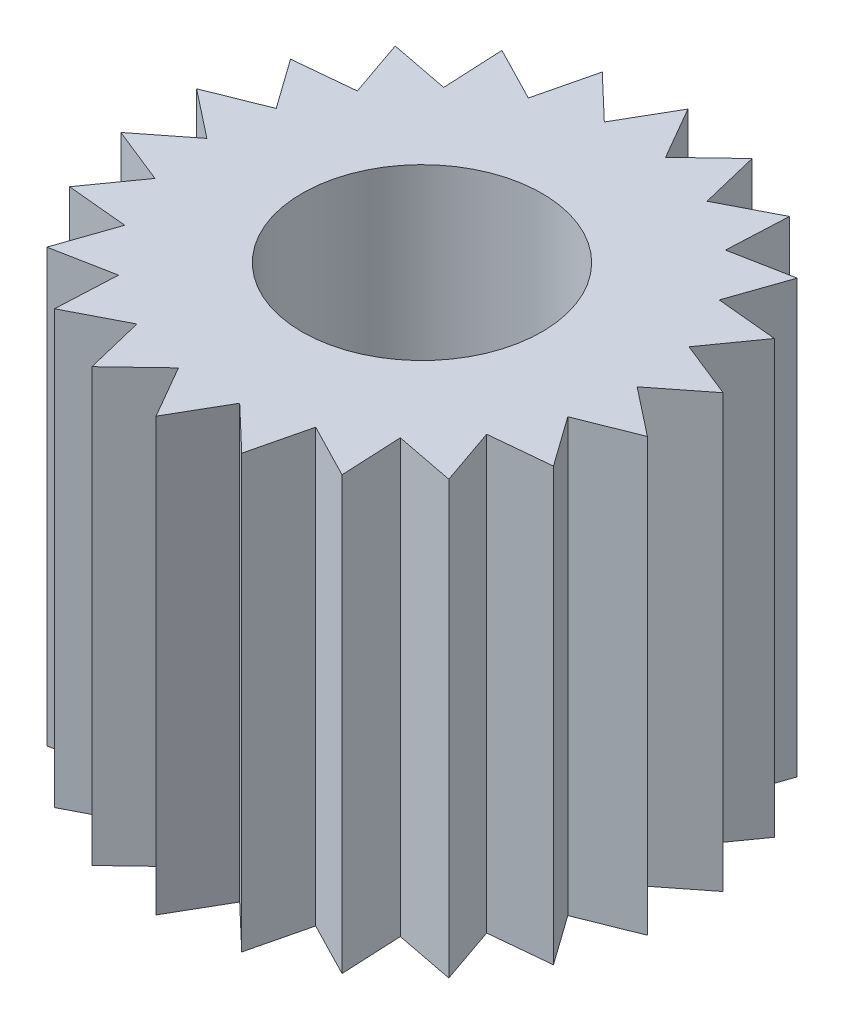
from build123d import *

# Parameters (mm, degrees)
SKETCH1_R           = 2.5
BOSS_EXTRUDE1_DEPTH = 9


with BuildPart() as part:
    # Sketch1 → Boss-Extrude1 (new body)
    with BuildSketch(Plane(origin=(0, 0, 0), x_dir=(1, 0, 0), z_dir=(0, 1, 0))):
        Polygon((1.561153305, 5.316799887), (0.637864624, 4.436445909), (0, 5.541259846), (-0.637864624, 4.436445909), (-1.561153305, 5.316799887), (-1.861917874, 4.077031446), (-2.995831253, 4.661604422), (-2.935129611, 3.387320142), (-4.18780477, 3.62875349), (-3.770554603, 2.423188306), (-5.040507251, 2.301922531), (-4.300511685, 1.262744164), (-5.484857811, 0.788603499), (-4.482066887, 0), (-5.484857811, -0.788603499), (-4.300511685, -1.262744164), (-5.040507251, -2.301922531), (-3.770554603, -2.423188306), (-4.18780477, -3.62875349), (-2.935129611, -3.387320142), (-2.941213111, -3.515028519), (-2.995831253, -4.661604422), (-1.861917874, -4.077031446), (-1.561153305, -5.316799887), (-0.637864624, -4.436445909), (0, -5.541259846), (0.637864624, -4.436445909), (1.561153305, -5.316799887), (1.861917874, -4.077031446), (2.995831253, -4.661604422), (2.935129611, -3.387320142), (4.18780477, -3.62875349), (3.770554603, -2.423188306), (5.040507251, -2.301922531), (4.300511685, -1.262744164), (5.484857811, -0.788603499), (4.482066887, 0), (5.484857811, 0.788603499), (4.300511685, 1.262744164), (5.040507251, 2.301922531), (3.770554603, 2.423188306), (4.18780477, 3.62875349), (3.001290377, 3.400071585), (2.935129611, 3.387320142), (2.941213111, 3.515028519), (2.995831253, 4.661604422), (1.861917874, 4.077031446), align=None)
        with Locations(Location((0, 0, 0), (0, 0, 270))):
            Circle(SKETCH1_R, mode=Mode.SUBTRACT)
    extrude(amount=BOSS_EXTRUDE1_DEPTH)


solid = part.part
